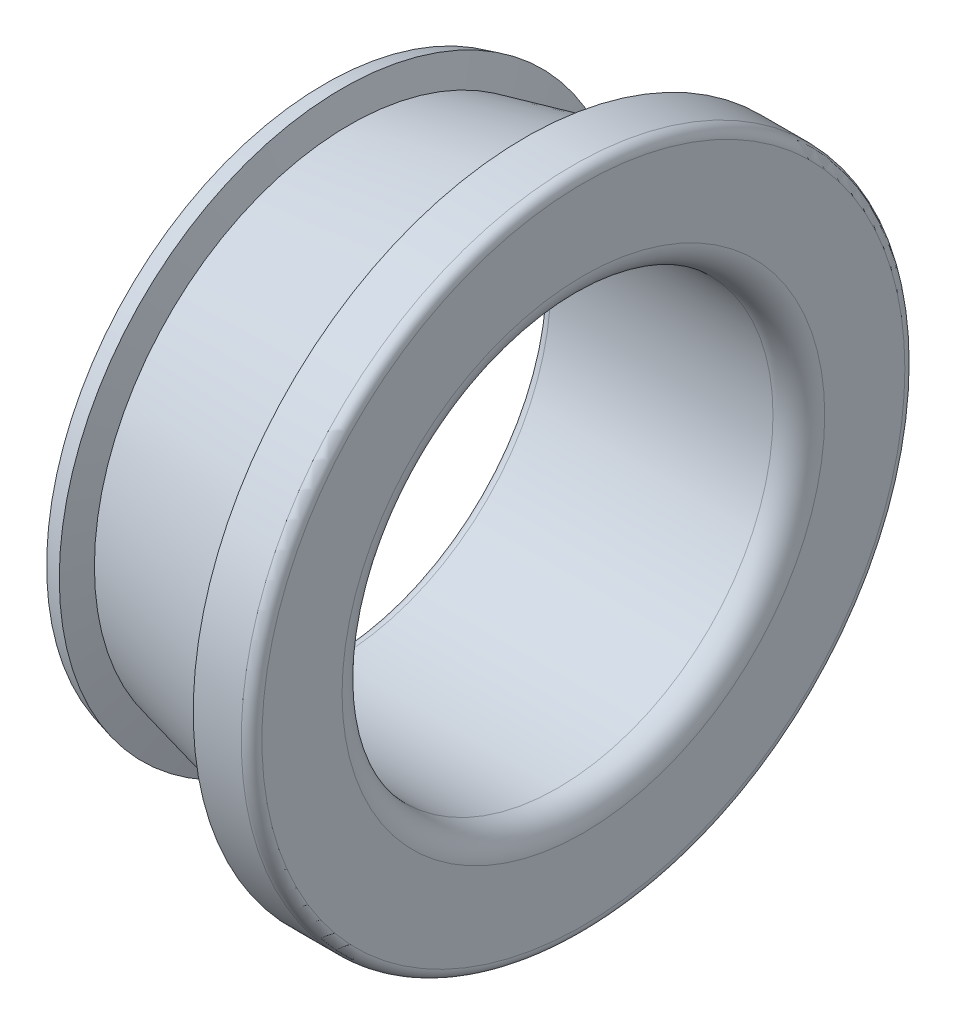
from build123d import *


with BuildPart() as part:
    # Esquisse1 → Base-Révolution (revolve)
    with BuildSketch(Plane.XY, mode=Mode.PRIVATE) as base_r_volution_sk:
        with BuildLine():
            Line((0, 14), (0, 18.65))
            ThreePointArc((0, 18.65), (-0.175735931, 19.074264069), (-0.6, 19.25))
            Line((-0.6, 19.25), (-3.385649604, 19.25))
            Line((-3.385649604, 19.25), (-2.868011513, 17.318148347))
            Line((-2.868011513, 17.318148347), (-13.569257226, 14.798339466))
            Line((-13.569257226, 14.798339466), (-14, 16.405893383))
            Line((-14, 16.405893383), (-15, 16.137944191))
            Line((-15, 16.137944191), (-15, 13.1))
            ThreePointArc((-15, 13.1), (-14.824264069, 12.675735931), (-14.4, 12.5))
            Line((-14.4, 12.5), (-1.5, 12.5))
            ThreePointArc((-1.5, 12.5), (-0.439339828, 12.939339828), (0, 14))
        make_face()
    revolve(base_r_volution_sk.sketch.rotate(Axis((0, 0, 0), (-1, 0, 0)), 90), axis=Axis((0, 0, 0), (-1, 0, 0)))


solid = part.part
